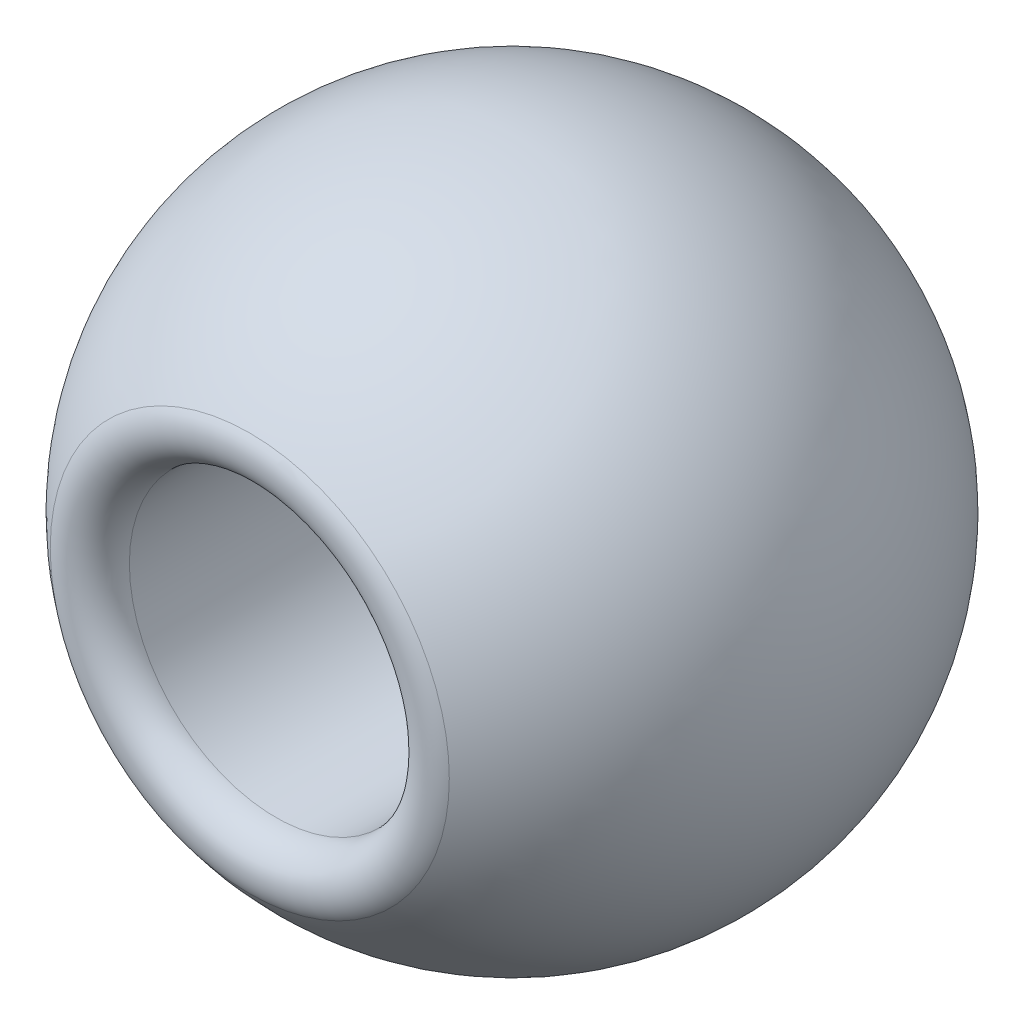
from build123d import *

# Parameters (mm, degrees)
SKETCH_2_R          = 4.45
CUT_EXTRUDE_1_DEPTH = 15
FILLET_1_R          = 1


with BuildPart() as part:
    # 스케치1 → 회전2 (revolve)
    with BuildSketch(Plane.XY):
        with BuildLine():
            Line((0, 10), (0, -10))
            ThreePointArc((0, -10), (-10, 0), (0, 10))
        make_face()
    revolve(axis=Axis((0, 11.789684906, 0), (0, -1, 0)))

    # 스케치2 → 컷-돌출1 (cut, symmetric)
    with BuildSketch(Plane.XY):
        with Locations(Location((0, 0, 0), (0, 0, 180))):
            Circle(SKETCH_2_R)
    extrude(amount=CUT_EXTRUDE_1_DEPTH, both=True, mode=Mode.SUBTRACT)

    # 필렛1
    fillet_1_edges = [part.edges().sort_by_distance(p)[0] for p in [
        (4.45, 0, 8.95530569),
        (4.45, 0, -8.95530569),
    ]]
    fillet(fillet_1_edges, radius=FILLET_1_R)


solid = part.part
